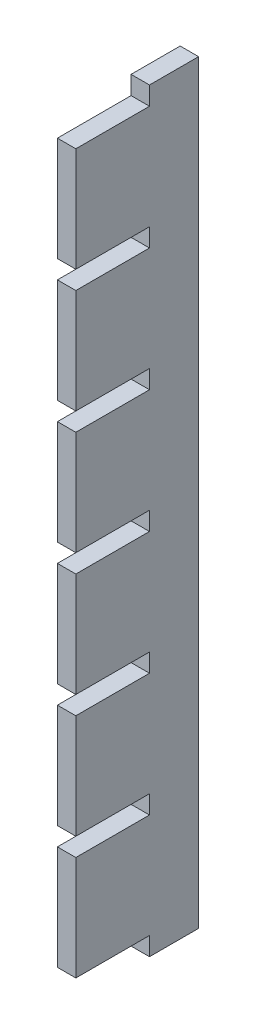
from build123d import *

# Parameters (mm, degrees)
SKETCH1_W           = 20
SKETCH1_H           = 123
BOSS_EXTRUDE1_DEPTH = 3
SKETCH2_W           = 12
SKETCH2_H           = 3
CUT_EXTRUDE1_DEPTH  = 125.651514231
LPATTERN1_COUNT     = 7
LPATTERN1_PITCH     = 20


with BuildPart() as part:
    # Sketch1 → Boss-Extrude1 (new body)
    with BuildSketch(Plane(origin=(0, 0, 0), x_dir=(0, 0, -1), z_dir=(1, 0, 0))):
        with Locations((10, 61.5)):
            Rectangle(SKETCH1_W, SKETCH1_H)
    extrude(amount=BOSS_EXTRUDE1_DEPTH)

    # Sketch2 → Cut-Extrude1 (cut, through all)
    with BuildSketch(Plane(origin=(3, 0, 0), x_dir=(0, 0, -1), z_dir=(1, 0, 0))):
        with Locations((6, 1.5)):
            Rectangle(SKETCH2_W, SKETCH2_H)
    cut_extrude1 = extrude(amount=-CUT_EXTRUDE1_DEPTH, mode=Mode.SUBTRACT)

    # LPattern1: Cut-Extrude1 ×7
    with Locations(*[(0, i * LPATTERN1_PITCH, 0) for i in range(1, LPATTERN1_COUNT)]):
        add(cut_extrude1, mode=Mode.SUBTRACT)


solid = part.part
